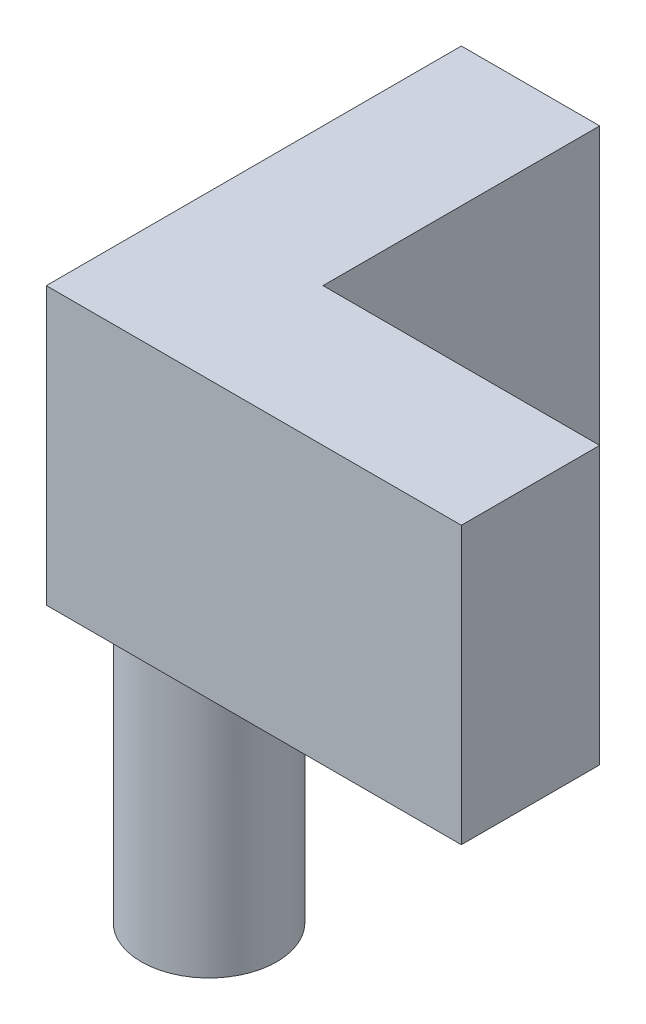
from build123d import *

# Parameters (mm, degrees)
SKETCH1_R           = 2.5
BOSS_EXTRUDE1_DEPTH = 10
SKETCH2_R           = 2.45
BOSS_EXTRUDE2_DEPTH = 20
BOSS_EXTRUDE3_START = -10
SKETCH3_R           = 2.5
BOSS_EXTRUDE3_DEPTH = 10


with BuildPart() as part:
    # Sketch1 → Boss-Extrude1 (new body)
    with BuildSketch(Plane(origin=(0, 0, 0), x_dir=(1, 0, 0), z_dir=(0, 1, 0))):
        Polygon((0, 15), (0, 0), (15, 0), (15, 5), (5, 5), (5, 15), align=None)
        with Locations(Location((2.879948547, 3.000793191, 0), (0, 0, 270))):
            Circle(SKETCH1_R, mode=Mode.SUBTRACT)
    extrude(amount=BOSS_EXTRUDE1_DEPTH)



with BuildPart() as body_2:
    # Sketch2 → Boss-Extrude2 (new body)
    with BuildSketch(Plane(origin=(0, 10, 0), x_dir=(1, 0, 0), z_dir=(0, 1, 0))):
        with Locations(Location((2.879948547, 3.000793191, 0), (0, 0, 270))):
            Circle(SKETCH2_R)
    extrude(amount=-BOSS_EXTRUDE2_DEPTH)


with BuildPart() as part_1:
    add(part.part)

    add(body_2.part)  # Boss-Extrude3 merges body 2
    # Sketch3 → Boss-Extrude3 (add)
    with BuildSketch(Plane(origin=(0, 10, 0), x_dir=(1, 0, 0), z_dir=(0, 1, 0)).offset(BOSS_EXTRUDE3_START)):
        with Locations((2.879948547, 3.000793191)):
            Circle(SKETCH3_R)
    extrude(amount=BOSS_EXTRUDE3_DEPTH)


solid = part_1.part
